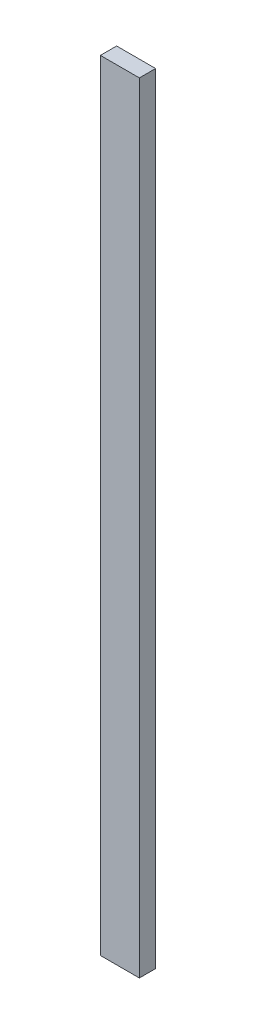
from build123d import *

# Parameters (mm, degrees)
ESQUISSE1_W        = 60
ESQUISSE1_H        = 1200
BOSS_EXTRU_1_DEPTH = 25


with BuildPart() as part:
    # Esquisse1 → Boss.-Extru.1 (new body)
    with BuildSketch(Plane.XY):
        with Locations((30, 600)):
            Rectangle(ESQUISSE1_W, ESQUISSE1_H)
    extrude(amount=BOSS_EXTRU_1_DEPTH)


solid = part.part
